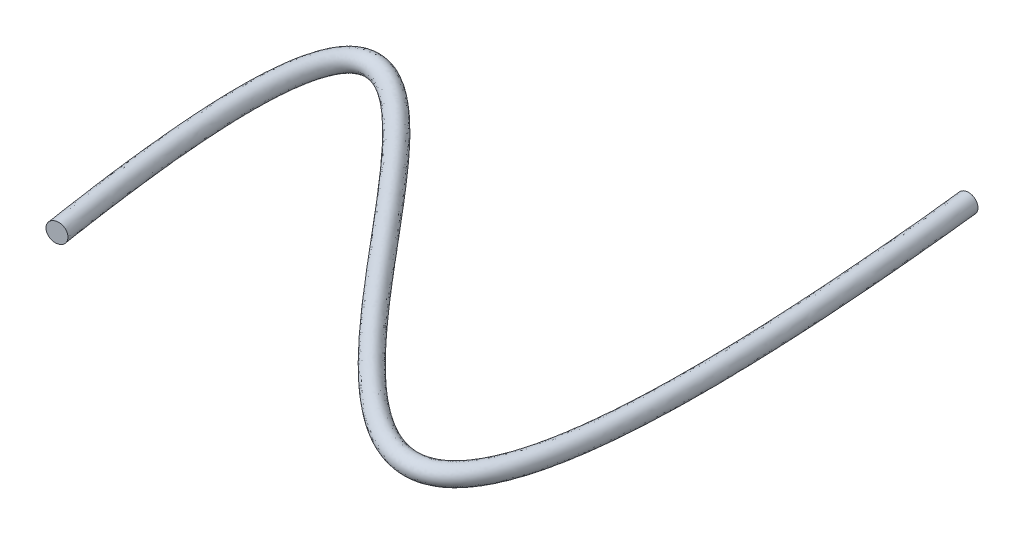
from build123d import *

# Parameters (mm, degrees)
SKETCH6_R = 1.5875


with BuildPart() as part:
    # Sweep1: sweep along a path in Sketch4
    with BuildLine() as sweep1_path:  # in the path sketch's own coordinates; laid on its plane below (add() does not lay a ready-made edge on the line's plane)
        add(Edge.make_bspline(
            [(0, 0), (-25.486036872, 161.478484295), (94.623890288, -139.606097555), (70.940964741, 79.434647897)],
            knots=[0, 0, 0, 0, 1, 1, 1, 1], degree=3))
    # Sketch6 → Sweep1 (sweep)
    with BuildSketch(Plane(origin=(0, 0, 0), x_dir=(0.9877729201796388, 0, -0.15589951301973023), z_dir=(0.15589951301973023, 0, 0.9877729201796388))):
        Circle(SKETCH6_R)
    sweep(path=Plane(origin=(0, 0, 0), x_dir=(1, 0, 0), z_dir=(0, 1, 0)) * sweep1_path.line)


solid = part.part
